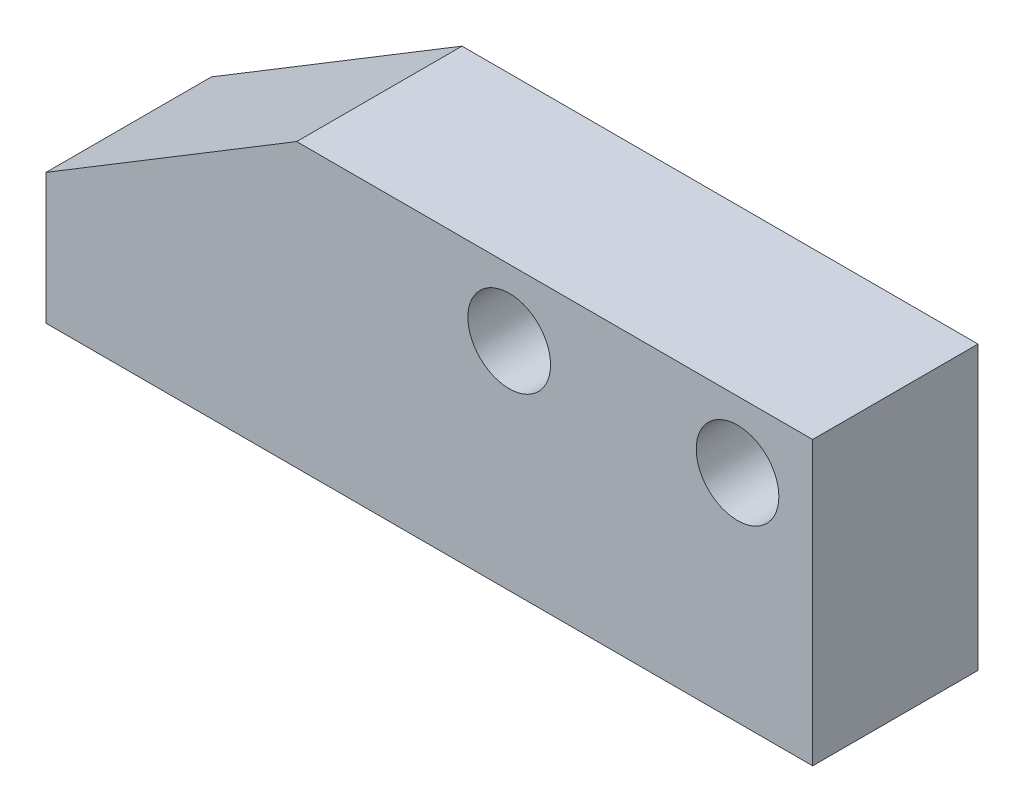
from build123d import *

# Parameters (mm, degrees)
SKETCH1_R           = 15
BOSS_EXTRUDE1_DEPTH = 60


with BuildPart() as part:
    # Sketch1 → Boss-Extrude1 (new body)
    with BuildSketch(Plane.XY):
        Polygon((-76.451612903, 87.580645161), (110.806451613, 87.580645161), (110.806451613, -15), (-167.419354839, -15), (-167.419354839, 32.419354839), align=None)
        with Locations((83.538694654, 63.474457894)):
            Circle(SKETCH1_R, mode=Mode.SUBTRACT)
        with Locations((0.674711509, 63.474457894)):
            Circle(SKETCH1_R, mode=Mode.SUBTRACT)
    extrude(amount=BOSS_EXTRUDE1_DEPTH)


solid = part.part
